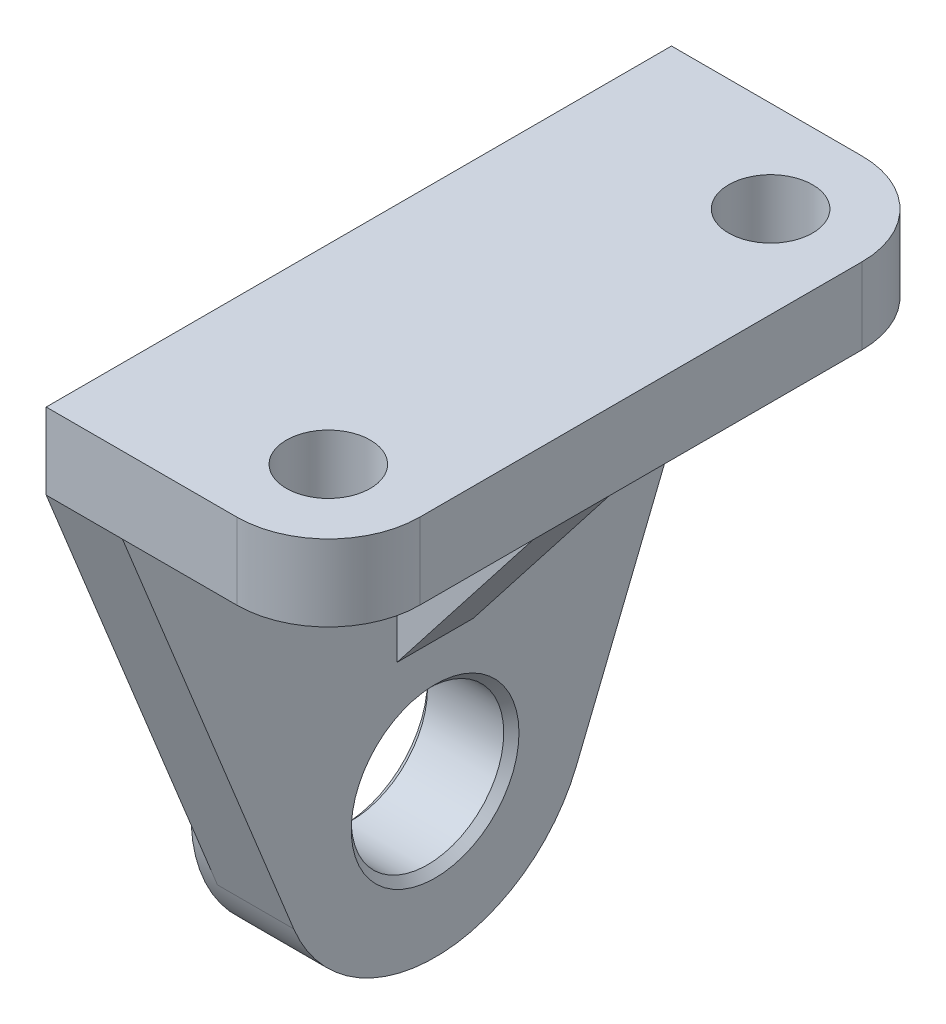
from build123d import *

# Parameters (mm, degrees)
EXTRUSION1_DEPTH                                = 10
ESQUISSE2_R                                     = 20
EXTRUSION2_DEPTH                                = 12
ESQUISSE3_W                                     = 82
ESQUISSE3_H                                     = 10
EXTRUSION3_DEPTH                                = 37
CONG_1_R                                        = 12
CHAMBRAGE_POUR_VIS_T_TE_CYLINDRIQUE_D           = 11
CHAMBRAGE_POUR_VIS_T_TE_CYLINDRIQUE_CBORE_D     = 22
CHAMBRAGE_POUR_VIS_T_TE_CYLINDRIQUE_CBORE_DEPTH = 1
D_GAGEMENT_M1_61_D                              = 20
NERVURE1_REACH                                  = 77.987
ESQUISSE9_WALL_W                                = 194.58156294
ESQUISSE9_WALL_H                                = 10
CHANFREIN1_SIZE                                 = 1


with BuildPart() as part:
    # Esquisse1 → Extrusion1 (new body)
    with BuildSketch(Plane(origin=(0, 0, 0), x_dir=(0, 0, -1), z_dir=(1, 0, 0))):
        with BuildLine():
            Line((-41, 58), (41, 58))
            Line((41, 58), (41, 48))
            Line((41, 48), (18.539491779, -7.502482561))
            ThreePointArc((18.539491779, -7.502482561), (0, -20), (-18.539491779, -7.502482561))
            Line((-18.539491779, -7.502482561), (-41, 48))
            Line((-41, 48), (-41, 58))
        make_face()
    extrude(amount=-EXTRUSION1_DEPTH)

    # Esquisse2 → Extrusion2 (add)
    with BuildSketch(Plane(origin=(0, 0, 0), x_dir=(0, 0, -1), z_dir=(1, 0, 0))):
        Circle(ESQUISSE2_R)
    extrude(amount=-EXTRUSION2_DEPTH)

    # Esquisse3 → Extrusion3 (add)
    with BuildSketch(Plane.ZY.offset(10)):
        with Locations((0, 53)):
            Rectangle(ESQUISSE3_W, ESQUISSE3_H)
    extrude(amount=-EXTRUSION3_DEPTH)

    # Congé1
    cong_1_edges = [part.edges().sort_by_distance(p)[0] for p in [
        (27, 53, -41),
        (27, 53, 41),
    ]]
    fillet(cong_1_edges, radius=CONG_1_R)

    # Chambrage pour vis à tête cylindrique à 6 pans creux (ou vis CHC) M41 (through all)
    with Locations(Plane.XZ.offset(-48)):
        with Locations((15, 29), (15, -29)):
            CounterBoreHole(CHAMBRAGE_POUR_VIS_T_TE_CYLINDRIQUE_D / 2, CHAMBRAGE_POUR_VIS_T_TE_CYLINDRIQUE_CBORE_D / 2, CHAMBRAGE_POUR_VIS_T_TE_CYLINDRIQUE_CBORE_DEPTH)

    # Dégagement M1.61 (through all)
    with Locations(Plane.ZY.offset(12)):
        with Locations((0, 0)):
            Hole(D_GAGEMENT_M1_61_D / 2)

    # Esquisse9 wall → Nervure1 (add, up to next)
    with BuildSketch(Plane(origin=(12.5, 32, 0), x_dir=(-0.615644041972, -0.788024373725, 0), z_dir=(0.788024373725, -0.615644041972, 0)), mode=Mode.PRIVATE) as nervure1_sk1:
        Rectangle(ESQUISSE9_WALL_W, ESQUISSE9_WALL_H)
    nervure1_tool1 = extrude(nervure1_sk1.sketch, amount=-NERVURE1_REACH, mode=Mode.PRIVATE) - part.part
    add(nervure1_tool1.solids().sort_by_distance((12.5, 32, 0))[0])

    # Chanfrein1
    chanfrein1_edges = [part.edges().sort_by_distance(p)[0] for p in [
        (0, 0, 10),
        (-12, 0, 10),
    ]]
    chamfer(chanfrein1_edges, length=CHANFREIN1_SIZE)


solid = part.part
